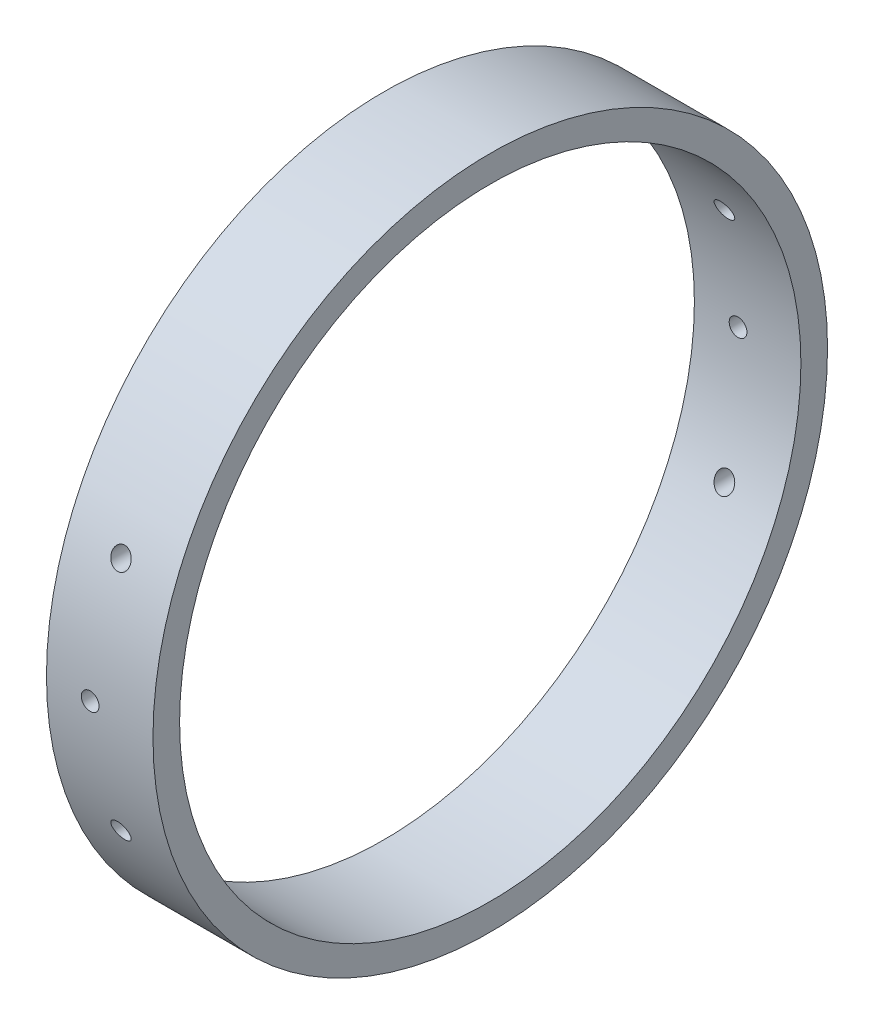
from build123d import *

# Parameters (mm, degrees)
SKETCH1_R           = 950
SKETCH1_R_2         = 875
BOSS_EXTRUDE1_DEPTH = 150
SKETCH2_R           = 25
SKETCH2_R_2         = 27
CUT_EXTRUDE1_DEPTH  = 2318.037764043


with BuildPart() as part:
    # Sketch1 → Boss-Extrude1 (new, symmetric)
    with BuildSketch(Plane(origin=(0, 0, 0), x_dir=(0, 0, -1), z_dir=(1, 0, 0))):
        Circle(SKETCH1_R)
        Circle(SKETCH1_R_2, mode=Mode.SUBTRACT)
    extrude(amount=BOSS_EXTRUDE1_DEPTH, both=True)

    # Sketch2 → Cut-Extrude1 (cut, through all)
    with BuildSketch(Plane.XY.offset(1158)):
        with Locations((-27, 0)):
            Circle(SKETCH2_R)
        with Locations((0, 332)):
            Circle(SKETCH2_R_2)
        with Locations((0, -332)):
            Circle(SKETCH2_R_2)
    extrude(amount=-CUT_EXTRUDE1_DEPTH, mode=Mode.SUBTRACT)


solid = part.part
